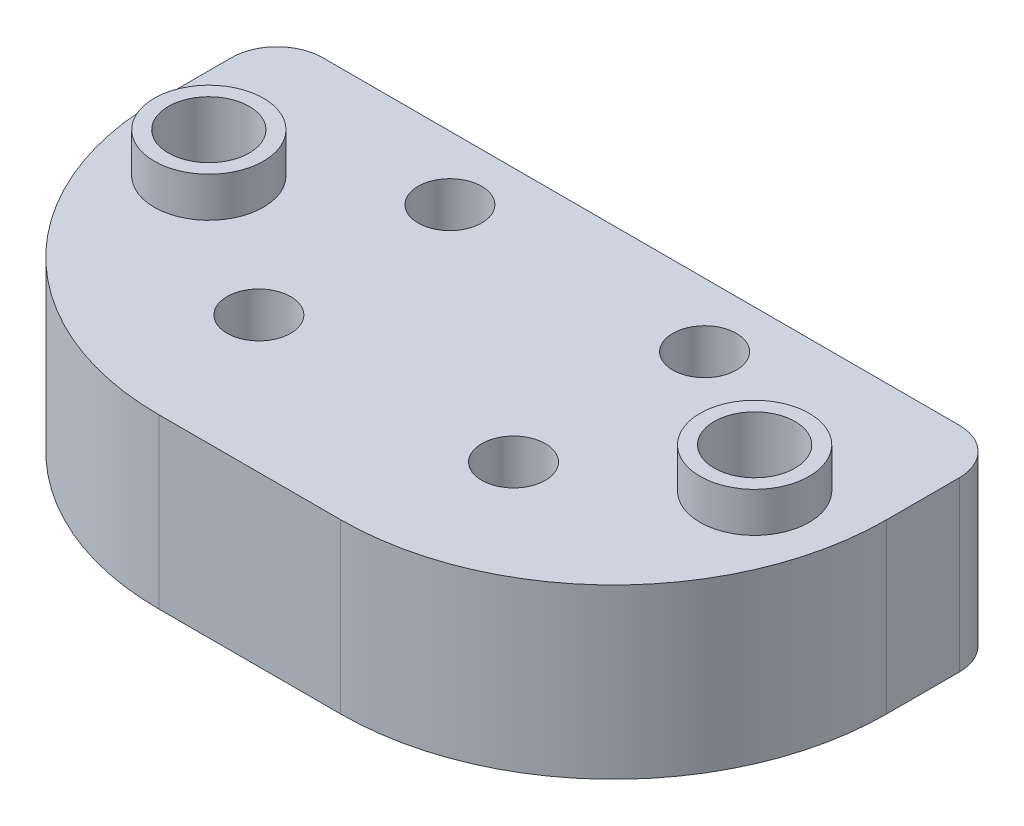
from build123d import *

# Parameters (mm, degrees)
SKETCH1_W           = 80
SKETCH1_H           = 43
SKETCH1_R           = 3.5
SKETCH1_R_2         = 4.445
BOSS_EXTRUDE1_DEPTH = 18.5
SKETCH1_4_R         = 4.35
SKETCH1_4_R_2       = 3.5
CUT_EXTRUDE1_DEPTH  = 6
FILLET1_R           = 30
FILLET2_R           = 5
BOSS_EXTRUDE2_START = 18.5
SKETCH1_5_R         = 6
SKETCH1_5_R_2       = 4.445
BOSS_EXTRUDE2_DEPTH = 4.3864


with BuildPart() as part:
    # Sketch1 → Boss-Extrude1 (new body)
    with BuildSketch(Plane(origin=(0, 0, 0), x_dir=(1, 0, 0), z_dir=(0, 1, 0))):
        with Locations((40, -29.5)):
            Rectangle(SKETCH1_W, SKETCH1_H)
        with Locations((26, -36)):
            Circle(SKETCH1_R, mode=Mode.SUBTRACT)
        with Locations((54, -36)):
            Circle(SKETCH1_R, mode=Mode.SUBTRACT)
        with Locations((26, -15)):
            Circle(SKETCH1_R, mode=Mode.SUBTRACT)
        with Locations((54, -15)):
            Circle(SKETCH1_R, mode=Mode.SUBTRACT)
        with Locations((70, -25.5)):
            Circle(SKETCH1_R_2, mode=Mode.SUBTRACT)
        with Locations((10, -25.5)):
            Circle(SKETCH1_R_2, mode=Mode.SUBTRACT)
    extrude(amount=BOSS_EXTRUDE1_DEPTH)

    # Sketch1<4> → Cut-Extrude1 (cut)
    # profile 1 of 4: a face of its own
    with BuildSketch(Plane(origin=(0, 0, 0), x_dir=(1, 0, 0), z_dir=(0, 1, 0))):
        with Locations((26, -15)):
            Circle(SKETCH1_4_R)
        with Locations((26, -15)):
            Circle(SKETCH1_4_R_2, mode=Mode.SUBTRACT)
    # profile 2 of 4: a face of its own
    with BuildSketch(Plane(origin=(0, 0, 0), x_dir=(1, 0, 0), z_dir=(0, 1, 0))):
        with Locations((54, -15)):
            Circle(SKETCH1_4_R)
        with Locations((54, -15)):
            Circle(SKETCH1_4_R_2, mode=Mode.SUBTRACT)
    # profile 3 of 4: a face of its own
    with BuildSketch(Plane(origin=(0, 0, 0), x_dir=(1, 0, 0), z_dir=(0, 1, 0))):
        with Locations((26, -36)):
            Circle(SKETCH1_4_R)
        with Locations((26, -36)):
            Circle(SKETCH1_4_R_2, mode=Mode.SUBTRACT)
    # profile 4 of 4: a face of its own
    with BuildSketch(Plane(origin=(0, 0, 0), x_dir=(1, 0, 0), z_dir=(0, 1, 0))):
        with Locations((54, -36)):
            Circle(SKETCH1_4_R)
        with Locations((54, -36)):
            Circle(SKETCH1_4_R_2, mode=Mode.SUBTRACT)
    extrude(amount=CUT_EXTRUDE1_DEPTH, mode=Mode.SUBTRACT)

    # Fillet1
    fillet1_edges = [part.edges().sort_by_distance(p)[0] for p in [
        (80, 9.25, 51),
        (0, 9.25, 51),
    ]]
    fillet(fillet1_edges, radius=FILLET1_R)

    # Fillet2
    fillet2_edges = [part.edges().sort_by_distance(p)[0] for p in [
        (0, 9.25, 8),
        (80, 9.25, 8),
    ]]
    fillet(fillet2_edges, radius=FILLET2_R)

    # Sketch1<5> → Boss-Extrude2 (add)
    # profile 1 of 2: a face of its own
    with BuildSketch(Plane(origin=(0, 0, 0), x_dir=(1, 0, 0), z_dir=(0, 1, 0)).offset(BOSS_EXTRUDE2_START)):
        with Locations((70, -25.5)):
            Circle(SKETCH1_5_R)
        with Locations((70, -25.5)):
            Circle(SKETCH1_5_R_2, mode=Mode.SUBTRACT)
    # profile 2 of 2: a face of its own
    with BuildSketch(Plane(origin=(0, 0, 0), x_dir=(1, 0, 0), z_dir=(0, 1, 0)).offset(BOSS_EXTRUDE2_START)):
        with Locations((10, -25.5)):
            Circle(SKETCH1_5_R)
        with Locations((10, -25.5)):
            Circle(SKETCH1_5_R_2, mode=Mode.SUBTRACT)
    extrude(amount=BOSS_EXTRUDE2_DEPTH)


solid = part.part
